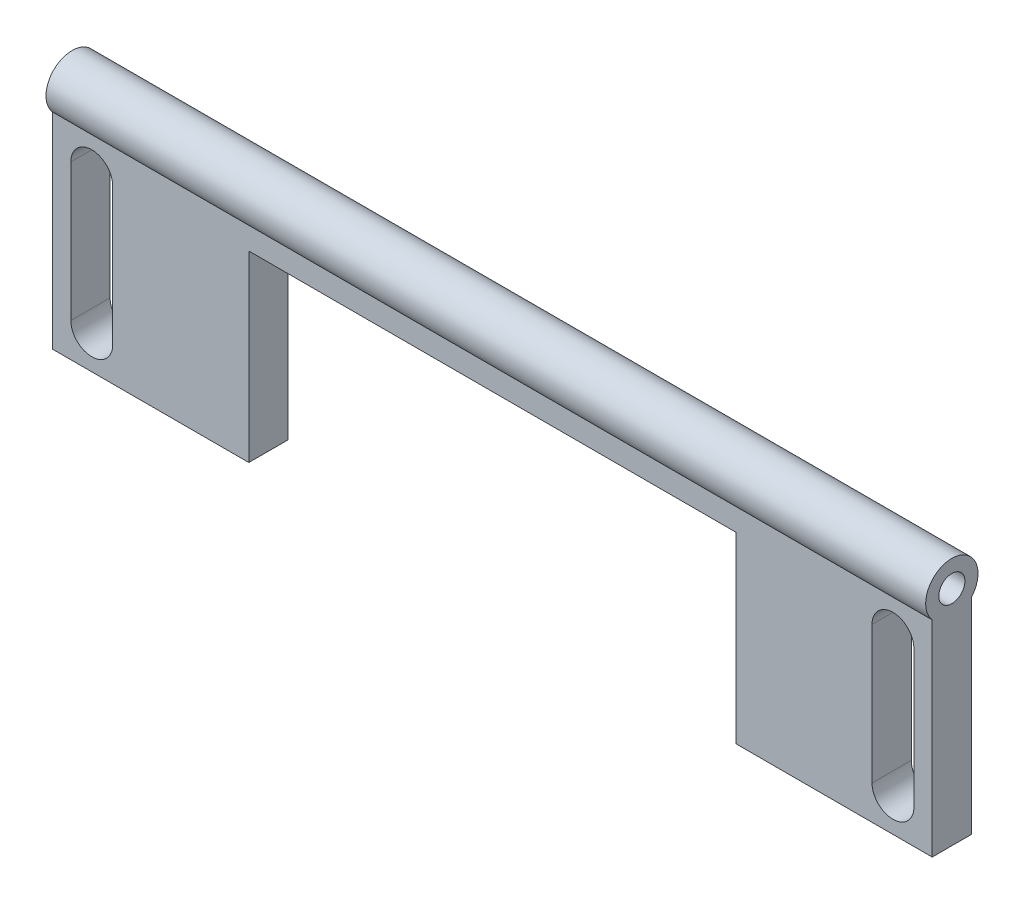
from build123d import *

# Parameters (mm, degrees)
SKETCH1_R           = 1
BOSS_EXTRUDE1_DEPTH = 33.615
CUT_EXTRUDE1_DEPTH  = 39.782573705
SKETCH3_W           = 37.23
SKETCH3_H           = 14
CUT_EXTRUDE3_DEPTH  = 10


with BuildPart() as part:
    # Sketch1 → Boss-Extrude1 (new body)
    with BuildSketch(Plane(origin=(0, 0, 0), x_dir=(0, 0, -1), z_dir=(1, 0, 0))):
        with BuildLine():
            ThreePointArc((0, 15.7), (1.5, 19.022875656), (3, 15.7))
            Line((3, 15.7), (3, 0))
            Line((3, 0), (0, 0))
            Line((0, 0), (0, 15.7))
        make_face()
        with Locations((1.5, 17.022875656)):
            Circle(SKETCH1_R, mode=Mode.SUBTRACT)
    boss_extrude1 = extrude(amount=BOSS_EXTRUDE1_DEPTH)

    # Sketch2 → Cut-Extrude1 (cut, through all)
    with BuildSketch(Plane(origin=(0, 0, -3), x_dir=(-1, 0, 0), z_dir=(0, 0, -1))):
        with BuildLine():
            Line((-1.4, 13.1), (-1.4, 2.6))
            ThreePointArc((-1.4, 2.6), (-3, 1), (-4.6, 2.6))
            Line((-4.6, 2.6), (-4.6, 13.1))
            ThreePointArc((-4.6, 13.1), (-3, 14.7), (-1.4, 13.1))
        make_face()
    cut_extrude1 = extrude(amount=-CUT_EXTRUDE1_DEPTH, mode=Mode.SUBTRACT)

    # Mirror1: Boss-Extrude1, Cut-Extrude1 across plane
    add(boss_extrude1.mirror(Plane(origin=(33.615, 0, 0), x_dir=(0, 0, 1), z_dir=(1, 0, 0))))
    add(cut_extrude1.mirror(Plane(origin=(33.615, 0, 0), x_dir=(0, 0, 1), z_dir=(1, 0, 0))), mode=Mode.SUBTRACT)

    # Sketch3 → Cut-Extrude3 (cut)
    with BuildSketch(Plane(origin=(0, 0, -3), x_dir=(-1, 0, 0), z_dir=(0, 0, -1))):
        with Locations((-33.615, 7)):
            Rectangle(SKETCH3_W, SKETCH3_H)
    extrude(amount=-CUT_EXTRUDE3_DEPTH, mode=Mode.SUBTRACT)


solid = part.part
